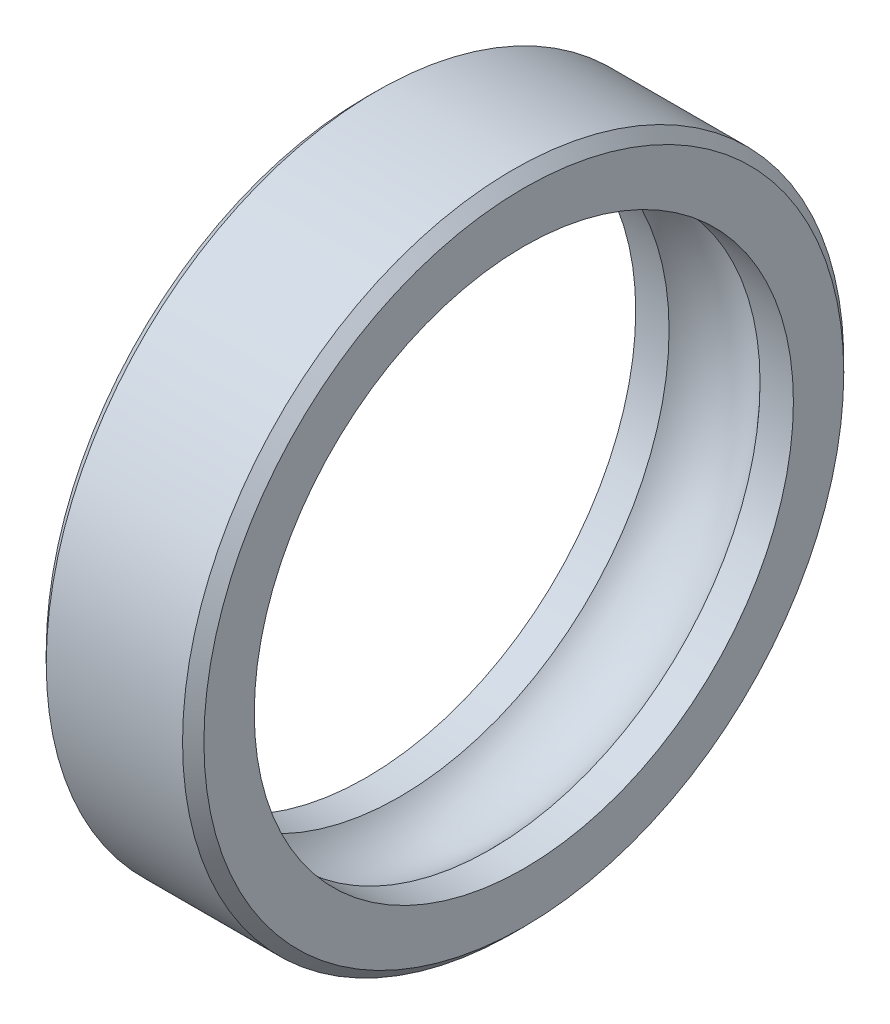
from build123d import *

# Parameters (mm, degrees)
CHAMFER1_SIZE = 2.1


with BuildPart() as part:
    # Sketch1 → Revolve1 (revolve)
    with BuildSketch(Plane.XY, mode=Mode.PRIVATE) as revolve1_sk:
        with BuildLine():
            Line((15.5, 53), (8.94427191, 53))
            ThreePointArc((8.94427191, 53), (0, 57), (-8.94427191, 53))
            Line((-8.94427191, 53), (-15.5, 53))
            Line((-15.5, 53), (-15.5, 65))
            Line((-15.5, 65), (15.5, 65))
            Line((15.5, 65), (15.5, 53))
        make_face()
    revolve(revolve1_sk.sketch.rotate(Axis((-15.998214286, 0, 0), (1, 0, 0)), 90), axis=Axis((-15.998214286, 0, 0), (1, 0, 0)))

    # Chamfer1
    chamfer1_edges = [part.edges().sort_by_distance(p)[0] for p in [
        (15.5, 0, -65),
        (-15.5, 0, -65),
    ]]
    chamfer(chamfer1_edges, length=CHAMFER1_SIZE)


solid = part.part
